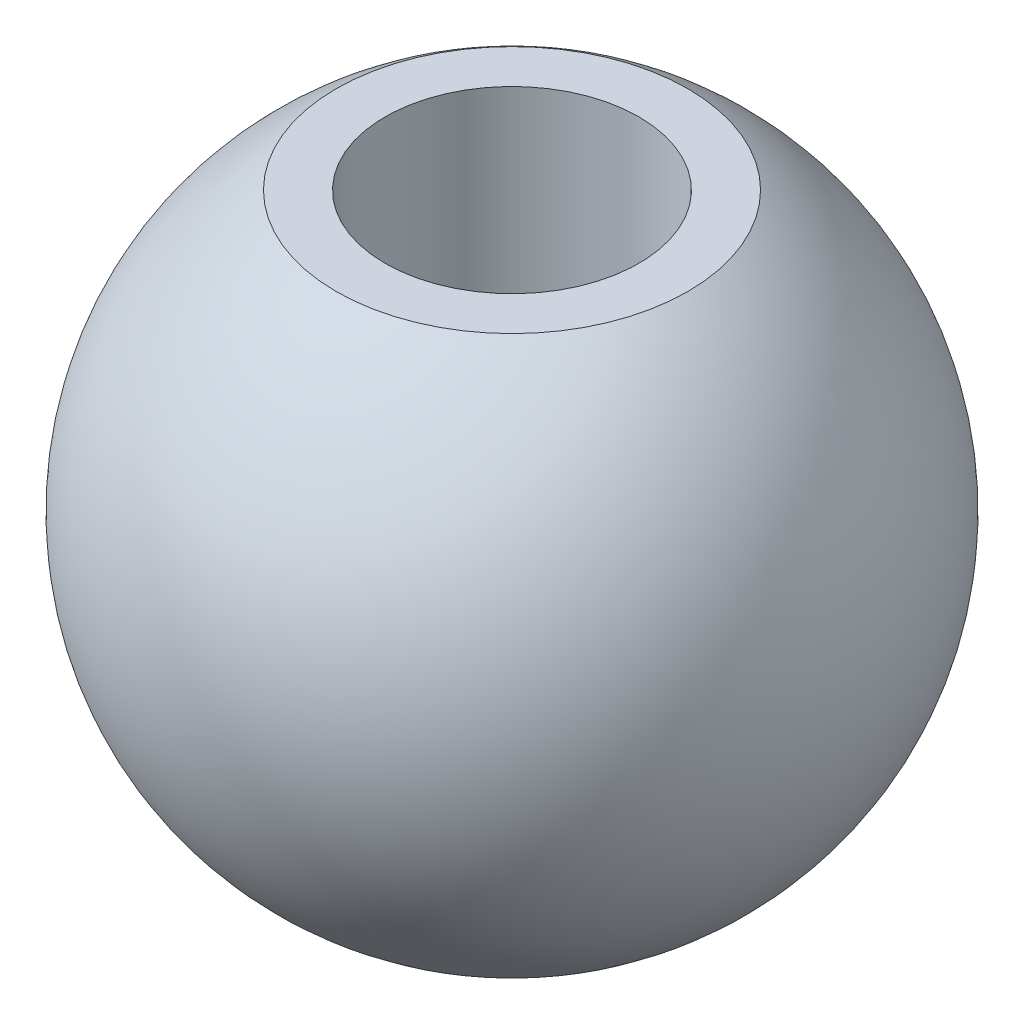
from build123d import *


with BuildPart() as part:
    # Sketch1 → Revolve1 (revolve)
    with BuildSketch(Plane.XY):
        with BuildLine():
            Line((-2.111658116, 3.35), (-1.525, 3.35))
            Line((-1.525, 3.35), (-1.525, -3.35))
            Line((-1.525, -3.35), (-2.111658116, -3.35))
            ThreePointArc((-2.111658116, -3.35), (-3.96, 0), (-2.111658116, 3.35))
        make_face()
    revolve(axis=Axis((0, 74.938684288, 0), (0, -1, 0)))


solid = part.part
